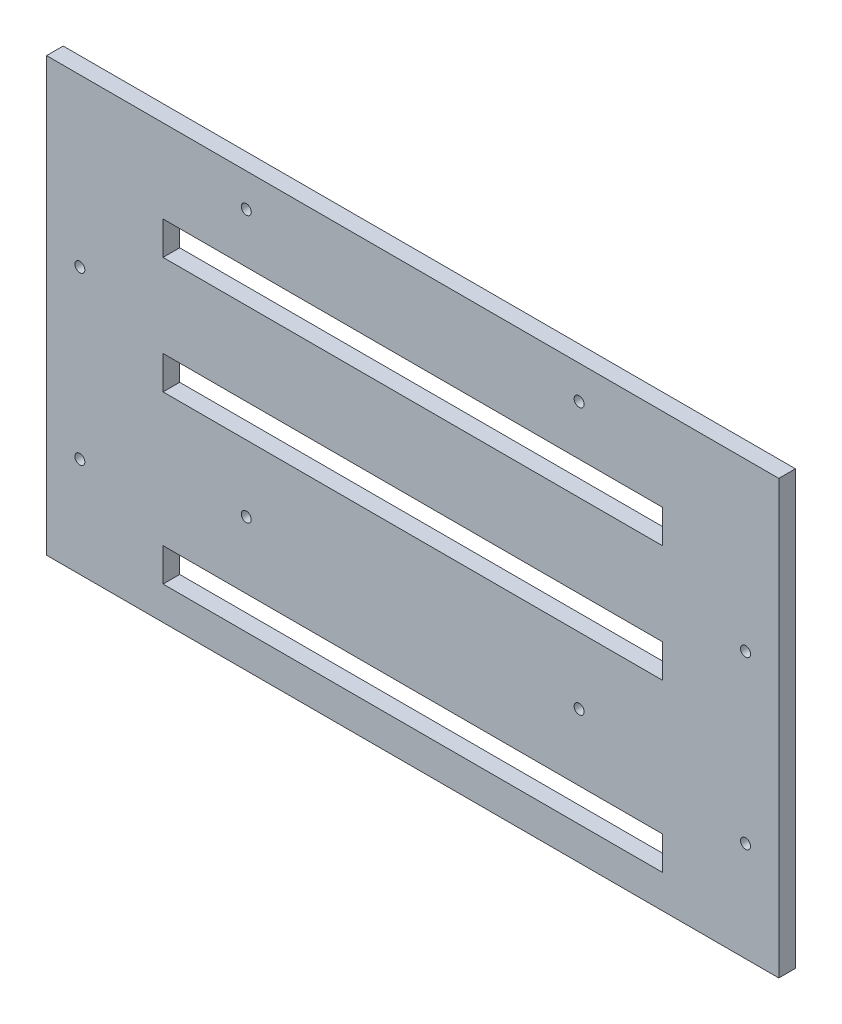
from build123d import *

# Parameters (mm, degrees)
SKETCH_1_W          = 220
SKETCH_1_H          = 130
EXTRUDE_1_DEPTH     = 5
SKETCH_2_R          = 1.5
CUT_EXTRUDE_1_DEPTH = 5
SKETCH_3_R          = 1.5
CUT_EXTRUDE_2_DEPTH = 5
SKETCH_4_W          = 150
SKETCH_4_H          = 10
CUT_EXTRUDE_3_DEPTH = 10


with BuildPart() as part:
    # 草图1 → 凸台-拉伸1 (new body)
    with BuildSketch(Plane.XY):
        Rectangle(SKETCH_1_W, SKETCH_1_H)
    extrude(amount=EXTRUDE_1_DEPTH)

    # 草图2 → 切除-拉伸1 (cut)
    with BuildSketch(Plane.XY.offset(5)):
        with Locations((-50, 55)):
            Circle(SKETCH_2_R)
        with Locations((50, 55)):
            Circle(SKETCH_2_R)
        with Locations((50, -25)):
            Circle(SKETCH_2_R)
        with Locations((-50, -25)):
            Circle(SKETCH_2_R)
    extrude(amount=-CUT_EXTRUDE_1_DEPTH, mode=Mode.SUBTRACT)

    # 草图3 → 切除-拉伸2 (cut)
    with BuildSketch(Plane.XY.offset(5)):
        with Locations((100, 15)):
            Circle(SKETCH_3_R)
        with Locations((100, -35)):
            Circle(SKETCH_3_R)
        with Locations((-100, 15)):
            Circle(SKETCH_3_R)
        with Locations((-100, -35)):
            Circle(SKETCH_3_R)
    extrude(amount=-CUT_EXTRUDE_2_DEPTH, mode=Mode.SUBTRACT)

    # 草图4 → 切除-拉伸3 (cut)
    with BuildSketch(Plane.XY.offset(5)):
        Rectangle(SKETCH_4_W, SKETCH_4_H)
        with Locations((0, 35)):
            Rectangle(SKETCH_4_W, SKETCH_4_H)
        with Locations((0, -50)):
            Rectangle(SKETCH_4_W, SKETCH_4_H)
    extrude(amount=-CUT_EXTRUDE_3_DEPTH, mode=Mode.SUBTRACT)


solid = part.part
